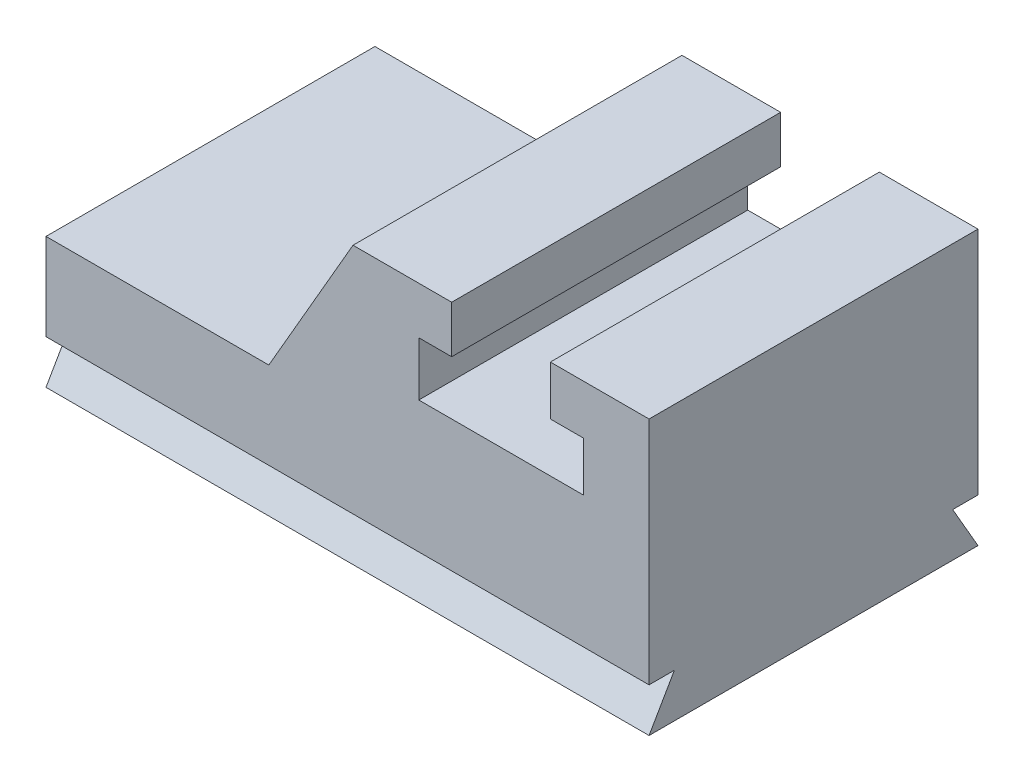
from build123d import *

# Parameters (mm, degrees)
BOSS_EXTRUDE1_DEPTH = 60
BOSS_EXTRUDE2_DEPTH = 110


with BuildPart() as part:
    # Sketch1 → Boss-Extrude1 (new body)
    with BuildSketch(Plane.XY):
        Polygon((0, 0), (110, 0), (110, 42), (92, 42), (92, 33), (98, 33), (98, 24), (68, 24), (68, 33.834738617), (74, 33.834738617), (74, 42.44856661), (56, 42.44856661), (40.640659473, 15.845408447), (0, 15.845408447), align=None)
    extrude(amount=BOSS_EXTRUDE1_DEPTH)

    # Sketch2 → Boss-Extrude2 (add)
    with BuildSketch(Plane.ZY):
        Polygon((0, -8), (60, -8), (55.381197846, 0), (4.618802154, 0), align=None)
    extrude(amount=-BOSS_EXTRUDE2_DEPTH)


solid = part.part
